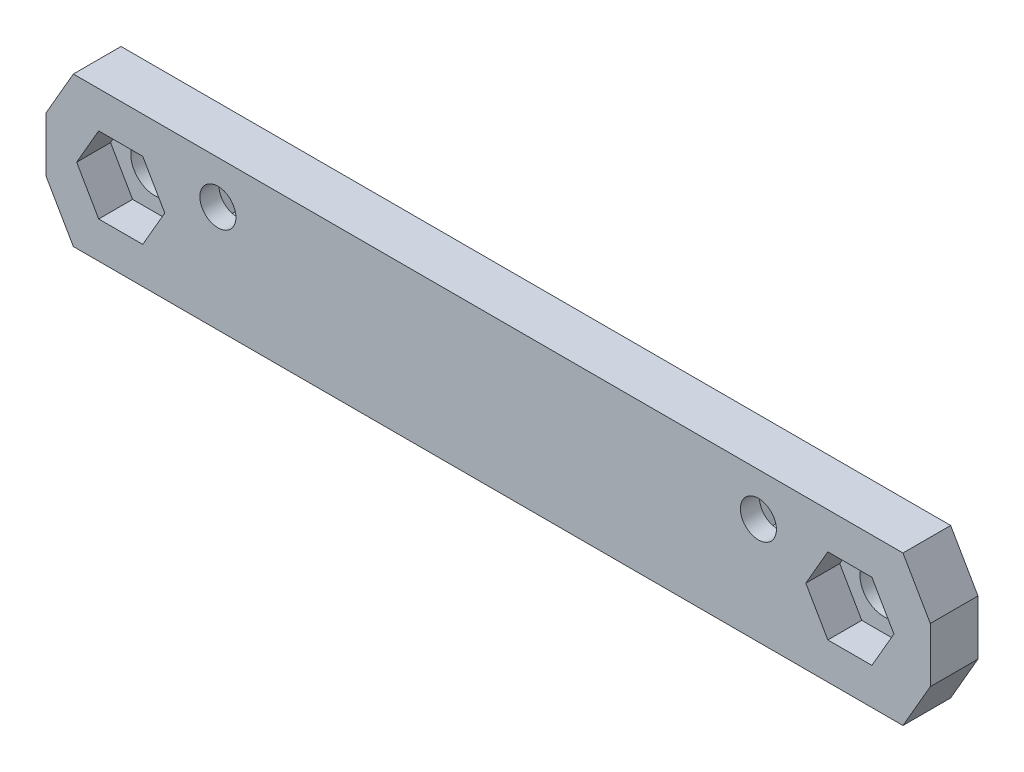
from build123d import *

# Parameters (mm, degrees)
SKETCH1_W            = 92
SKETCH1_H            = 75
BOSS_EXTRUDE1_DEPTH  = 4.5
M4_CLEARANCE_HOLE1_D = 4.5
M3_CLEARANCE_HOLE1_D = 3.4
CUT_EXTRUDE1_DEPTH   = 3.2
CUT_EXTRUDE2_DEPTH   = 2.7
SKETCH10_W           = 92
SKETCH10_H           = 29.25
SKETCH10_H_2         = 28.3
CUT_EXTRUDE3_DEPTH   = 60.51890456
CUT_EXTRUDE4_DEPTH   = 10


with BuildPart() as part:
    # Sketch1 → Boss-Extrude1 (new body)
    with BuildSketch(Plane.XY):
        Rectangle(SKETCH1_W, SKETCH1_H)
    extrude(amount=BOSS_EXTRUDE1_DEPTH)

    # M4 Clearance Hole1 (through all)
    with Locations(Plane.XY.offset(4.5)):
        with Locations((-34.669877487, -1.6), (34.130122513, -1.6)):
            Hole(M4_CLEARANCE_HOLE1_D / 2)

    # M3 Clearance Hole1 (through all)
    with Locations(Plane.XY.offset(4.5)):
        with Locations((-25.5, 1.4), (25.5, 1.4)):
            Hole(M3_CLEARANCE_HOLE1_D / 2)

    # Sketch8 → Cut-Extrude1 (cut)
    with BuildSketch(Plane.XY.offset(4.5)):
        Polygon((-30.512955548, -1.6), (-32.591416518, 2), (-36.748338456, 2), (-38.826799425, -1.6), (-36.748338456, -5.2), (-32.591416518, -5.2), align=None)
        Polygon((29.973200575, -1.6), (32.051661544, -5.2), (36.208583482, -5.2), (38.287044452, -1.6), (36.208583482, 2), (32.051661544, 2), align=None)
    extrude(amount=-CUT_EXTRUDE1_DEPTH, mode=Mode.SUBTRACT)

    # Sketch9 → Cut-Extrude2 (cut)
    with BuildSketch(Plane(origin=(0, 0, 0), x_dir=(-1, 0, 0), z_dir=(0, 0, -1))):
        Polygon((-22.209103466, 1.4), (-23.854551733, 4.25), (-27.145448267, 4.25), (-28.790896534, 1.4), (-27.145448267, -1.45), (-23.854551733, -1.45), align=None)
        Polygon((22.209103466, 1.4), (23.854551733, -1.45), (27.145448267, -1.45), (28.790896534, 1.4), (27.145448267, 4.25), (23.854551733, 4.25), align=None)
    extrude(amount=-CUT_EXTRUDE2_DEPTH, mode=Mode.SUBTRACT)

    # Sketch10 → Cut-Extrude3 (cut, through all)
    with BuildSketch(Plane(origin=(0, 0, 0), x_dir=(-1, 0, 0), z_dir=(0, 0, -1))):
        with Locations((0, 22.875)):
            Rectangle(SKETCH10_W, SKETCH10_H)
        with Locations((0, -23.35)):
            Rectangle(SKETCH10_W, SKETCH10_H_2)
    extrude(amount=-CUT_EXTRUDE3_DEPTH, mode=Mode.SUBTRACT)

    # Sketch11 → Cut-Extrude4 (cut)
    with BuildSketch(Plane.XY.offset(4.5)):
        Polygon((-39.13939839, 5.45), (-41.719877487, 0.980479097), (-41.719877487, -4.180479097), (-39.13939839, -8.65), (0, -8.65), (0, -18.65), (-51, -18.65), (-51, 15.45), (0, 15.45), (0, 5.45), align=None)
    cut_extrude4 = extrude(amount=-CUT_EXTRUDE4_DEPTH, mode=Mode.SUBTRACT)

    # Mirror1: Cut-Extrude4 across plane
    add(cut_extrude4.mirror(Plane(origin=(0, 0, 0), x_dir=(0, 0, 1), z_dir=(1, 0, 0))), mode=Mode.SUBTRACT)


solid = part.part
